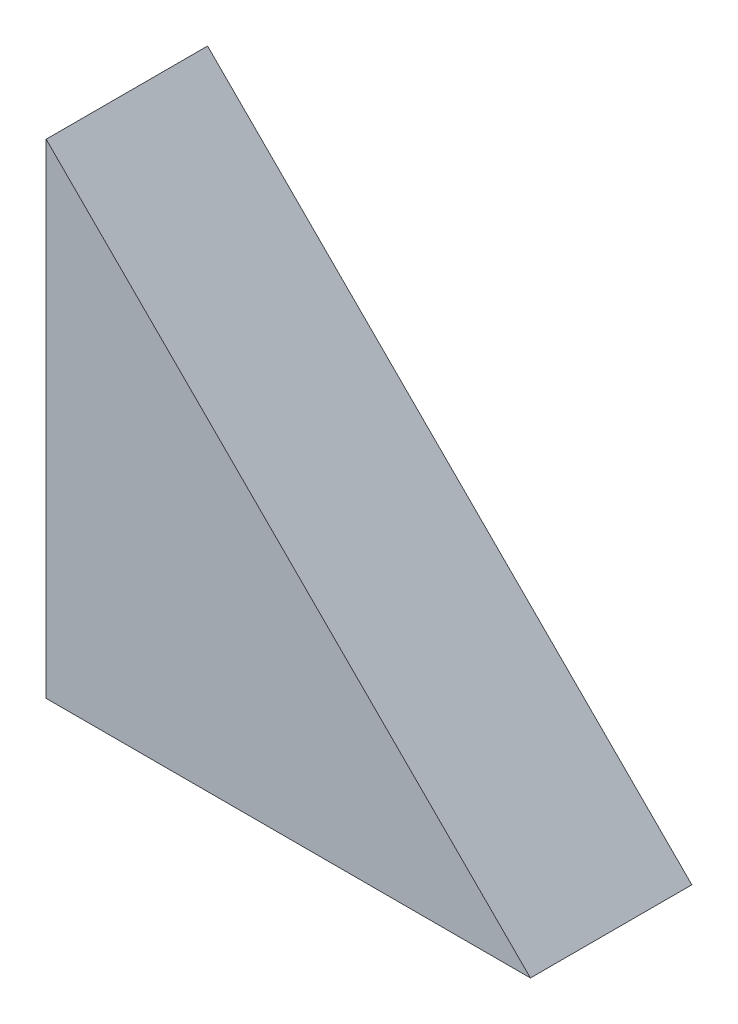
from build123d import *

# Parameters (mm, degrees)
SALIENTE_EXTRUIR1_DEPTH = 6.35


with BuildPart() as part:
    # Croquis1 → Saliente-Extruir1 (new, symmetric)
    with BuildSketch(Plane.XY):
        Polygon((0, 38.1), (0, 0), (38.1, 0), align=None)
    extrude(amount=SALIENTE_EXTRUIR1_DEPTH, both=True)


solid = part.part
